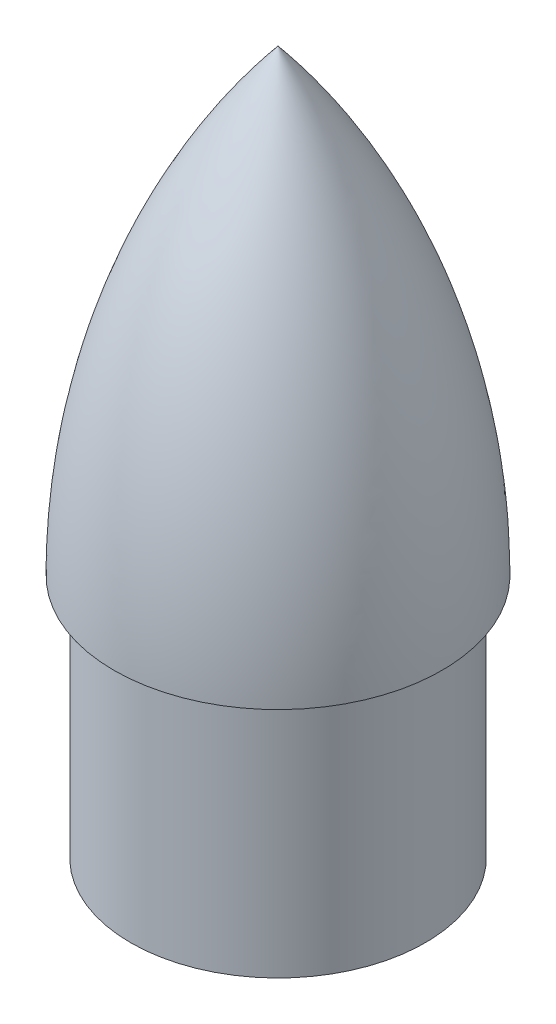
from build123d import *

# Parameters (mm, degrees)
SKETCH2_R           = 30.15
BOSS_EXTRUDE1_DEPTH = 50
SKETCH3_R           = 27.75
CUT_EXTRUDE1_DEPTH  = 63
CHAMFER1_SIZE       = 10
CHAMFER1_SIZE2      = 12.348971565


with BuildPart() as part:
    # Sketch1 → Revolve1 (revolve)
    with BuildSketch(Plane(origin=(0, 0, 0), x_dir=(0, 0, -1), z_dir=(1, 0, 0))):
        with BuildLine():
            Line((0, 0), (33.570889043, 0))
            ThreePointArc((33.570889043, 0), (24.925862256, 49.860341433), (0, 93.9))
            Line((0, 93.9), (0, 0))
        make_face()
    revolve(axis=Axis((0, 0, 0), (0, 1, 0)))

    # Sketch2 → Boss-Extrude1 (add)
    with BuildSketch(Plane.XZ):
        with Locations(Location((0, 0, 0), (0, 0, 270))):
            Circle(SKETCH2_R)
    extrude(amount=BOSS_EXTRUDE1_DEPTH)

    # Sketch3 → Cut-Extrude1 (cut)
    with BuildSketch(Plane.XZ.offset(50)):
        with Locations(Location((0, 0, 0), (0, 0, 270))):
            Circle(SKETCH3_R)
    extrude(amount=-CUT_EXTRUDE1_DEPTH, mode=Mode.SUBTRACT)

    # Chamfer1
    chamfer1_edges = [part.edges().sort_by_distance(p)[0] for p in [
        (0, 13, 27.75),
    ]]
    chamfer1_side = [part.faces().sort_by_distance(p)[0] for p in [
        (0, -18.5, 27.75),
    ]]
    chamfer(chamfer1_edges, length=CHAMFER1_SIZE, length2=CHAMFER1_SIZE2, reference=chamfer1_side[0])


solid = part.part
